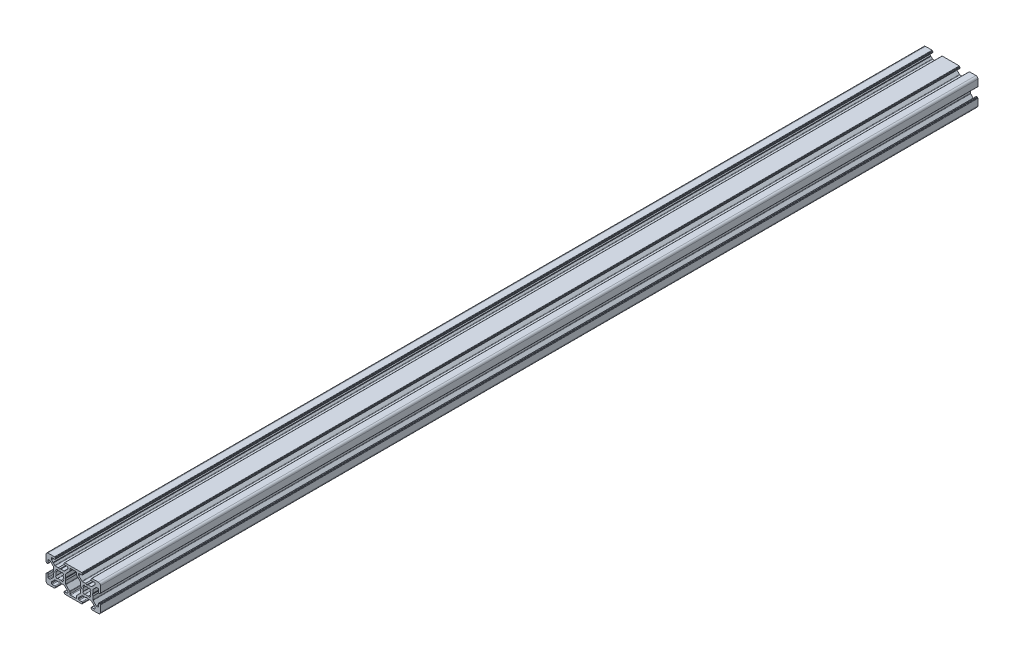
from build123d import *

# Parameters (mm, degrees)
EXTRUDE_827_DEPTH = 322.5


with BuildPart() as part:
    # Model → Extrude 827 (new, symmetric)
    with BuildSketch(Plane.XY):
        with BuildLine():
            Line((-14.790380224, 5.709619137), (-14.842144033, 5.902804302))
            Line((-14.842144033, 5.902804302), (-15.853552994, 6.914213263))
            ThreePointArc((-15.853552994, 6.914213263), (-15.96193937, 7.076424937), (-15.999999604, 7.267766654))
            Line((-15.999999604, 7.267766654), (-15.999999604, 7.999999642))
            ThreePointArc((-15.999999604, 7.999999642), (-15.853552994, 8.353553033), (-15.499999604, 8.499999642))
            Line((-15.499999604, 8.499999642), (-13.599999999, 8.499999642))
            ThreePointArc((-13.599999999, 8.499999642), (-13.246446608, 8.646446251), (-13.099999999, 8.999999642))
            Line((-13.099999999, 8.999999642), (-13.099999999, 9.299999969))
            ThreePointArc((-13.099999999, 9.299999969), (-13.158578643, 9.441421325), (-13.299999999, 9.499999969))
            Line((-13.299999999, 9.499999969), (-13.350000227, 9.499999969))
            ThreePointArc((-13.350000227, 9.499999969), (-13.491421583, 9.558578612), (-13.550000227, 9.699999969))
            Line((-13.550000227, 9.699999969), (-13.550000227, 9.799999969))
            ThreePointArc((-13.550000227, 9.799999969), (-13.60857887, 9.941421325), (-13.750000227, 9.999999969))
            Line((-13.750000227, 9.999999969), (-18.499999999, 9.999999969))
            ThreePointArc((-18.499999999, 9.999999969), (-19.560660171, 9.56066014), (-19.999999999, 8.499999969))
            Line((-19.999999999, 8.499999969), (-19.999999999, 3.750000196))
            ThreePointArc((-19.999999999, 3.750000196), (-19.941421355, 3.60857884), (-19.799999999, 3.550000196))
            Line((-19.799999999, 3.550000196), (-19.699999999, 3.550000196))
            ThreePointArc((-19.699999999, 3.550000196), (-19.558578643, 3.491421552), (-19.499999999, 3.350000196))
            Line((-19.499999999, 3.350000196), (-19.499999999, 3.299999969))
            ThreePointArc((-19.499999999, 3.299999969), (-19.441421355, 3.158578612), (-19.299999999, 3.099999969))
            Line((-19.299999999, 3.099999969), (-18.999999672, 3.099999969))
            ThreePointArc((-18.999999672, 3.099999969), (-18.646446282, 3.246446578), (-18.499999672, 3.599999969))
            Line((-18.499999672, 3.599999969), (-18.499999672, 5.500000655))
            ThreePointArc((-18.499999672, 5.500000655), (-18.353553063, 5.853554045), (-17.999999672, 6.000000655))
            Line((-17.999999672, 6.000000655), (-17.267766625, 6.000000655))
            ThreePointArc((-17.267766625, 6.000000655), (-17.076424898, 5.961940416), (-16.914213218, 5.853554028))
            Line((-16.914213218, 5.853554028), (-14.646446591, 3.585787181))
            ThreePointArc((-14.646446591, 3.585787181), (-14.538060228, 3.423575512), (-14.499999999, 3.232233807))
            Line((-14.499999999, 3.232233807), (-14.499999999, 0.95359028))
            ThreePointArc((-14.499999999, 0.95359028), (-14.493185165, 0.901826474), (-14.473205082, 0.853590285))
            Line((-14.473205082, 0.853590285), (-14.038119561, 0.100000013))
            ThreePointArc((-14.038119561, 0.100000013), (-14.011324631, -3.1e-08), (-14.038119561, -0.100000076))
            Line((-14.038119561, -0.100000076), (-14.473205082, -0.853590347))
            ThreePointArc((-14.473205082, -0.853590347), (-14.493185165, -0.901826537), (-14.499999999, -0.953590343))
            Line((-14.499999999, -0.953590343), (-14.499999999, -3.23223387))
            ThreePointArc((-14.499999999, -3.23223387), (-14.538060228, -3.423575575), (-14.646446591, -3.585787243))
            Line((-14.646446591, -3.585787243), (-16.914213218, -5.853554091))
            ThreePointArc((-16.914213218, -5.853554091), (-17.076424898, -5.961940479), (-17.267766625, -6.000000717))
            Line((-17.267766625, -6.000000717), (-17.999999672, -6.000000717))
            ThreePointArc((-17.999999672, -6.000000717), (-18.353553063, -5.853554108), (-18.499999672, -5.500000717))
            Line((-18.499999672, -5.500000717), (-18.499999672, -3.600000031))
            ThreePointArc((-18.499999672, -3.600000031), (-18.646446282, -3.246446641), (-18.999999672, -3.100000031))
            Line((-18.999999672, -3.100000031), (-19.299999999, -3.100000031))
            ThreePointArc((-19.299999999, -3.100000031), (-19.441421355, -3.158578675), (-19.499999999, -3.300000031))
            Line((-19.499999999, -3.300000031), (-19.499999999, -3.350000259))
            ThreePointArc((-19.499999999, -3.350000259), (-19.558578643, -3.491421615), (-19.699999999, -3.550000259))
            Line((-19.699999999, -3.550000259), (-19.799999999, -3.550000259))
            ThreePointArc((-19.799999999, -3.550000259), (-19.941421355, -3.608578903), (-19.999999999, -3.750000259))
            Line((-19.999999999, -3.750000259), (-19.999999999, -8.500000031))
            ThreePointArc((-19.999999999, -8.500000031), (-19.560660171, -9.560660203), (-18.499999999, -10.000000031))
            Line((-18.499999999, -10.000000031), (-13.750000227, -10.000000031))
            ThreePointArc((-13.750000227, -10.000000031), (-13.60857887, -9.941421388), (-13.550000227, -9.800000031))
            Line((-13.550000227, -9.800000031), (-13.550000227, -9.700000031))
            ThreePointArc((-13.550000227, -9.700000031), (-13.491421583, -9.558578675), (-13.350000227, -9.500000031))
            Line((-13.350000227, -9.500000031), (-13.299999999, -9.500000031))
            ThreePointArc((-13.299999999, -9.500000031), (-13.158578643, -9.441421388), (-13.099999999, -9.300000031))
            Line((-13.099999999, -9.300000031), (-13.099999999, -8.999999705))
            ThreePointArc((-13.099999999, -8.999999705), (-13.246446608, -8.646446314), (-13.599999999, -8.499999705))
            Line((-13.599999999, -8.499999705), (-15.499999604, -8.499999705))
            ThreePointArc((-15.499999604, -8.499999705), (-15.853552994, -8.353553095), (-15.999999604, -7.999999705))
            Line((-15.999999604, -7.999999705), (-15.999999604, -7.267766658))
            ThreePointArc((-15.999999604, -7.267766658), (-15.96193937, -7.076424942), (-15.853552994, -6.914213267))
            Line((-15.853552994, -6.914213267), (-13.585786098, -4.646446371))
            ThreePointArc((-13.585786098, -4.646446371), (-13.423574424, -4.538059995), (-13.232232708, -4.499999762))
            Line((-13.232232708, -4.499999762), (-10.953589301, -4.499999762))
            ThreePointArc((-10.953589301, -4.499999762), (-10.901825489, -4.493184926), (-10.853589297, -4.47320484))
            Line((-10.853589297, -4.47320484), (-10.099999968, -4.038119814))
            ThreePointArc((-10.099999968, -4.038119814), (-9.999999999, -4.011324902), (-9.90000003, -4.038119814))
            Line((-9.90000003, -4.038119814), (-9.146410702, -4.47320484))
            ThreePointArc((-9.146410702, -4.47320484), (-9.098174509, -4.493184926), (-9.046410697, -4.499999762))
            Line((-9.046410697, -4.499999762), (-6.767767291, -4.499999762))
            ThreePointArc((-6.767767291, -4.499999762), (-6.576425574, -4.538059995), (-6.4142139, -4.646446371))
            Line((-6.4142139, -4.646446371), (-4.146447004, -6.914213267))
            ThreePointArc((-4.146447004, -6.914213267), (-4.038060628, -7.076424942), (-4.000000394, -7.267766658))
            Line((-4.000000394, -7.267766658), (-4.000000394, -7.999999646))
            ThreePointArc((-4.000000394, -7.999999646), (-4.146447004, -8.353553037), (-4.500000394, -8.499999646))
            Line((-4.500000394, -8.499999646), (-6.399999999, -8.499999646))
            ThreePointArc((-6.399999999, -8.499999646), (-6.75355339, -8.646446255), (-6.899999999, -8.999999646))
            Line((-6.899999999, -8.999999646), (-6.899999999, -9.299999973))
            ThreePointArc((-6.899999999, -9.299999973), (-6.841421355, -9.441421329), (-6.699999999, -9.499999973))
            Line((-6.699999999, -9.499999973), (-6.649999772, -9.499999973))
            ThreePointArc((-6.649999772, -9.499999973), (-6.508578415, -9.558578616), (-6.449999772, -9.699999973))
            Line((-6.449999772, -9.699999973), (-6.449999772, -9.799999973))
            ThreePointArc((-6.449999772, -9.799999973), (-6.391421128, -9.941421329), (-6.249999772, -9.999999973))
            Line((-6.249999772, -9.999999973), (6.249999773, -9.999999973))
            ThreePointArc((6.249999773, -9.999999973), (6.39142113, -9.941421329), (6.449999773, -9.799999973))
            Line((6.449999773, -9.799999973), (6.449999773, -9.699999973))
            ThreePointArc((6.449999773, -9.699999973), (6.508578417, -9.558578616), (6.649999773, -9.499999973))
            Line((6.649999773, -9.499999973), (6.700000001, -9.499999973))
            ThreePointArc((6.700000001, -9.499999973), (6.841421357, -9.441421329), (6.900000001, -9.299999973))
            Line((6.900000001, -9.299999973), (6.900000001, -8.999999646))
            ThreePointArc((6.900000001, -8.999999646), (6.753553392, -8.646446255), (6.400000001, -8.499999646))
            Line((6.400000001, -8.499999646), (4.500000396, -8.499999646))
            ThreePointArc((4.500000396, -8.499999646), (4.146447006, -8.353553037), (4.000000396, -7.999999646))
            Line((4.000000396, -7.999999646), (4.000000396, -7.267766658))
            ThreePointArc((4.000000396, -7.267766658), (4.03806063, -7.076424942), (4.146447006, -6.914213267))
            Line((4.146447006, -6.914213267), (6.414213902, -4.646446371))
            ThreePointArc((6.414213902, -4.646446371), (6.576425576, -4.538059995), (6.767767292, -4.499999762))
            Line((6.767767292, -4.499999762), (9.046410699, -4.499999762))
            ThreePointArc((9.046410699, -4.499999762), (9.098174511, -4.493184926), (9.146410703, -4.47320484))
            Line((9.146410703, -4.47320484), (9.900000032, -4.038119814))
            ThreePointArc((9.900000032, -4.038119814), (10.000000001, -4.011324902), (10.09999997, -4.038119814))
            Line((10.09999997, -4.038119814), (10.853589298, -4.47320484))
            ThreePointArc((10.853589298, -4.47320484), (10.901825491, -4.493184926), (10.953589303, -4.499999762))
            Line((10.953589303, -4.499999762), (13.232232709, -4.499999762))
            ThreePointArc((13.232232709, -4.499999762), (13.423574426, -4.538059995), (13.5857861, -4.646446371))
            Line((13.5857861, -4.646446371), (15.853552996, -6.914213267))
            ThreePointArc((15.853552996, -6.914213267), (15.961939372, -7.076424942), (15.999999606, -7.267766658))
            Line((15.999999606, -7.267766658), (15.999999606, -7.999999705))
            ThreePointArc((15.999999606, -7.999999705), (15.853552996, -8.353553095), (15.499999606, -8.499999705))
            Line((15.499999606, -8.499999705), (13.600000001, -8.499999705))
            ThreePointArc((13.600000001, -8.499999705), (13.24644661, -8.646446314), (13.100000001, -8.999999705))
            Line((13.100000001, -8.999999705), (13.100000001, -9.300000031))
            ThreePointArc((13.100000001, -9.300000031), (13.158578645, -9.441421388), (13.300000001, -9.500000031))
            Line((13.300000001, -9.500000031), (13.350000228, -9.500000031))
            ThreePointArc((13.350000228, -9.500000031), (13.491421585, -9.558578675), (13.550000228, -9.700000031))
            Line((13.550000228, -9.700000031), (13.550000228, -9.800000031))
            ThreePointArc((13.550000228, -9.800000031), (13.608578872, -9.941421388), (13.750000228, -10.000000031))
            Line((13.750000228, -10.000000031), (18.500000001, -10.000000031))
            ThreePointArc((18.500000001, -10.000000031), (19.560660173, -9.560660203), (20.000000001, -8.500000031))
            Line((20.000000001, -8.500000031), (20.000000001, -3.750000259))
            ThreePointArc((20.000000001, -3.750000259), (19.941421357, -3.608578903), (19.800000001, -3.550000259))
            Line((19.800000001, -3.550000259), (19.700000001, -3.550000259))
            ThreePointArc((19.700000001, -3.550000259), (19.558578645, -3.491421615), (19.500000001, -3.350000259))
            Line((19.500000001, -3.350000259), (19.500000001, -3.300000031))
            ThreePointArc((19.500000001, -3.300000031), (19.441421357, -3.158578675), (19.300000001, -3.100000031))
            Line((19.300000001, -3.100000031), (18.999999674, -3.100000031))
            ThreePointArc((18.999999674, -3.100000031), (18.646446284, -3.246446641), (18.499999674, -3.600000031))
            Line((18.499999674, -3.600000031), (18.499999674, -5.500000717))
            ThreePointArc((18.499999674, -5.500000717), (18.353553065, -5.853554108), (17.999999674, -6.000000717))
            Line((17.999999674, -6.000000717), (17.267766627, -6.000000717))
            ThreePointArc((17.267766627, -6.000000717), (17.0764249, -5.961940479), (16.914213219, -5.853554091))
            Line((16.914213219, -5.853554091), (14.646446593, -3.585787243))
            ThreePointArc((14.646446593, -3.585787243), (14.53806023, -3.423575575), (14.500000001, -3.23223387))
            Line((14.500000001, -3.23223387), (14.500000001, -0.953590343))
            ThreePointArc((14.500000001, -0.953590343), (14.493185167, -0.901826537), (14.473205084, -0.853590347))
            Line((14.473205084, -0.853590347), (14.038119563, -0.100000076))
            ThreePointArc((14.038119563, -0.100000076), (14.011324633, -3.1e-08), (14.038119563, 0.100000013))
            Line((14.038119563, 0.100000013), (14.473205084, 0.853590285))
            ThreePointArc((14.473205084, 0.853590285), (14.493185167, 0.901826474), (14.500000001, 0.95359028))
            Line((14.500000001, 0.95359028), (14.500000001, 3.232233807))
            ThreePointArc((14.500000001, 3.232233807), (14.53806023, 3.423575512), (14.646446593, 3.585787181))
            Line((14.646446593, 3.585787181), (16.914213219, 5.853554028))
            ThreePointArc((16.914213219, 5.853554028), (17.0764249, 5.961940416), (17.267766627, 6.000000655))
            Line((17.267766627, 6.000000655), (17.999999674, 6.000000655))
            ThreePointArc((17.999999674, 6.000000655), (18.353553065, 5.853554045), (18.499999674, 5.500000655))
            Line((18.499999674, 5.500000655), (18.499999674, 3.599999969))
            ThreePointArc((18.499999674, 3.599999969), (18.646446284, 3.246446578), (18.999999674, 3.099999969))
            Line((18.999999674, 3.099999969), (19.300000001, 3.099999969))
            ThreePointArc((19.300000001, 3.099999969), (19.441421357, 3.158578612), (19.500000001, 3.299999969))
            Line((19.500000001, 3.299999969), (19.500000001, 3.350000196))
            ThreePointArc((19.500000001, 3.350000196), (19.558578645, 3.491421552), (19.700000001, 3.550000196))
            Line((19.700000001, 3.550000196), (19.800000001, 3.550000196))
            ThreePointArc((19.800000001, 3.550000196), (19.941421357, 3.60857884), (20.000000001, 3.750000196))
            Line((20.000000001, 3.750000196), (20.000000001, 8.499999969))
            ThreePointArc((20.000000001, 8.499999969), (19.560660173, 9.56066014), (18.500000001, 9.999999969))
            Line((18.500000001, 9.999999969), (13.750000228, 9.999999969))
            ThreePointArc((13.750000228, 9.999999969), (13.608578872, 9.941421325), (13.550000228, 9.799999969))
            Line((13.550000228, 9.799999969), (13.550000228, 9.699999969))
            ThreePointArc((13.550000228, 9.699999969), (13.491421585, 9.558578612), (13.350000228, 9.499999969))
            Line((13.350000228, 9.499999969), (13.300000001, 9.499999969))
            ThreePointArc((13.300000001, 9.499999969), (13.158578645, 9.441421325), (13.100000001, 9.299999969))
            Line((13.100000001, 9.299999969), (13.100000001, 8.999999642))
            ThreePointArc((13.100000001, 8.999999642), (13.24644661, 8.646446251), (13.600000001, 8.499999642))
            Line((13.600000001, 8.499999642), (15.499999606, 8.499999642))
            ThreePointArc((15.499999606, 8.499999642), (15.853552996, 8.353553033), (15.999999606, 7.999999642))
            Line((15.999999606, 7.999999642), (15.999999606, 7.267766654))
            ThreePointArc((15.999999606, 7.267766654), (15.961939372, 7.076424937), (15.853552996, 6.914213263))
            Line((15.853552996, 6.914213263), (13.5857861, 4.646446367))
            ThreePointArc((13.5857861, 4.646446367), (13.423574426, 4.538059991), (13.232232709, 4.499999757))
            Line((13.232232709, 4.499999757), (10.953589303, 4.499999757))
            ThreePointArc((10.953589303, 4.499999757), (10.901825491, 4.493184922), (10.853589298, 4.473204836))
            Line((10.853589298, 4.473204836), (10.09999997, 4.03811981))
            ThreePointArc((10.09999997, 4.03811981), (10.000000001, 4.011324897), (9.900000032, 4.03811981))
            Line((9.900000032, 4.03811981), (9.146410703, 4.473204836))
            ThreePointArc((9.146410703, 4.473204836), (9.098174511, 4.493184922), (9.046410699, 4.499999757))
            Line((9.046410699, 4.499999757), (6.767767292, 4.499999757))
            ThreePointArc((6.767767292, 4.499999757), (6.576425576, 4.538059991), (6.414213902, 4.646446367))
            Line((6.414213902, 4.646446367), (4.146447006, 6.914213263))
            ThreePointArc((4.146447006, 6.914213263), (4.03806063, 7.076424937), (4.000000396, 7.267766654))
            Line((4.000000396, 7.267766654), (4.000000396, 7.999999734))
            ThreePointArc((4.000000396, 7.999999734), (4.146446629, 8.35355271), (4.499999315, 8.499999642))
            Line((4.499999315, 8.499999642), (6.400000001, 8.499999642))
            ThreePointArc((6.400000001, 8.499999642), (6.753553392, 8.646446251), (6.900000001, 8.999999642))
            Line((6.900000001, 8.999999642), (6.900000001, 9.299999969))
            ThreePointArc((6.900000001, 9.299999969), (6.841421357, 9.441421325), (6.700000001, 9.499999969))
            Line((6.700000001, 9.499999969), (6.649999773, 9.499999969))
            ThreePointArc((6.649999773, 9.499999969), (6.508578417, 9.558578612), (6.449999773, 9.699999969))
            Line((6.449999773, 9.699999969), (6.449999773, 9.799999969))
            ThreePointArc((6.449999773, 9.799999969), (6.39142113, 9.941421325), (6.249999773, 9.999999969))
            Line((6.249999773, 9.999999969), (-6.249999772, 9.999999969))
            ThreePointArc((-6.249999772, 9.999999969), (-6.391421128, 9.941421325), (-6.449999772, 9.799999969))
            Line((-6.449999772, 9.799999969), (-6.449999772, 9.699999969))
            ThreePointArc((-6.449999772, 9.699999969), (-6.508578415, 9.558578612), (-6.649999772, 9.499999969))
            Line((-6.649999772, 9.499999969), (-6.699999999, 9.499999969))
            ThreePointArc((-6.699999999, 9.499999969), (-6.841421355, 9.441421325), (-6.899999999, 9.299999969))
            Line((-6.899999999, 9.299999969), (-6.899999999, 8.999999642))
            ThreePointArc((-6.899999999, 8.999999642), (-6.75355339, 8.646446251), (-6.399999999, 8.499999642))
            Line((-6.399999999, 8.499999642), (-4.500000302, 8.499999642))
            ThreePointArc((-4.500000302, 8.499999642), (-4.146446965, 8.353553048), (-4.000000394, 7.999999701))
            Line((-4.000000394, 7.999999701), (-4.000000394, 7.267766654))
            ThreePointArc((-4.000000394, 7.267766654), (-4.038060628, 7.076424937), (-4.146447004, 6.914213263))
            Line((-4.146447004, 6.914213263), (-6.4142139, 4.646446367))
            ThreePointArc((-6.4142139, 4.646446367), (-6.576425574, 4.538059991), (-6.767767291, 4.499999757))
            Line((-6.767767291, 4.499999757), (-9.046410697, 4.499999757))
            ThreePointArc((-9.046410697, 4.499999757), (-9.098174509, 4.493184922), (-9.146410702, 4.473204836))
            Line((-9.146410702, 4.473204836), (-9.90000003, 4.03811981))
            ThreePointArc((-9.90000003, 4.03811981), (-9.999999999, 4.011324897), (-10.099999968, 4.03811981))
            Line((-10.099999968, 4.03811981), (-10.853589297, 4.473204836))
            ThreePointArc((-10.853589297, 4.473204836), (-10.901825489, 4.493184922), (-10.953589301, 4.499999757))
            Line((-10.953589301, 4.499999757), (-13.232232708, 4.499999757))
            ThreePointArc((-13.232232708, 4.499999757), (-13.423574424, 4.538059991), (-13.585786098, 4.646446367))
            Line((-13.585786098, 4.646446367), (-14.597195059, 5.657855328))
            Line((-14.597195059, 5.657855328), (-14.790380224, 5.709619137))
        make_face()
        with BuildLine():
            Line((8.090069039, 2.992174922), (8.741814684, 2.445295392))
            ThreePointArc((8.741814684, 2.445295392), (10.000000001, 2.749999969), (11.258185318, 2.445295392))
            Line((11.258185318, 2.445295392), (11.909930962, 2.992174922))
            ThreePointArc((11.909930962, 2.992174922), (12.508410486, 2.511737229), (12.989640963, 1.913894988))
            Line((12.989640963, 1.913894988), (12.445295363, 1.258185405))
            ThreePointArc((12.445295363, 1.258185405), (12.750000001, -3.1e-08), (12.445295363, -1.258185468))
            Line((12.445295363, -1.258185468), (12.989640963, -1.913895051))
            ThreePointArc((12.989640963, -1.913895051), (12.508410486, -2.511737292), (11.909930962, -2.992174985))
            Line((11.909930962, -2.992174985), (11.258185318, -2.445295455))
            ThreePointArc((11.258185318, -2.445295455), (10.000000001, -2.750000031), (8.741814684, -2.445295455))
            Line((8.741814684, -2.445295455), (8.090069039, -2.992174985))
            ThreePointArc((8.090069039, -2.992174985), (7.491589516, -2.511737292), (7.010359039, -1.913895051))
            Line((7.010359039, -1.913895051), (7.554704639, -1.258185468))
            ThreePointArc((7.554704639, -1.258185468), (7.250000001, -3.1e-08), (7.554704639, 1.258185405))
            Line((7.554704639, 1.258185405), (7.010359039, 1.913894988))
            ThreePointArc((7.010359039, 1.913894988), (7.491589516, 2.511737229), (8.090069039, 2.992174922))
        make_face(mode=Mode.SUBTRACT)
        with BuildLine():
            Line((-7.010359037, 1.913894988), (-7.554704637, 1.258185405))
            ThreePointArc((-7.554704637, 1.258185405), (-7.249999999, -3.1e-08), (-7.554704637, -1.258185468))
            Line((-7.554704637, -1.258185468), (-7.010359037, -1.913895051))
            ThreePointArc((-7.010359037, -1.913895051), (-7.491589514, -2.511737292), (-8.090069038, -2.992174985))
            Line((-8.090069038, -2.992174985), (-8.741814682, -2.445295455))
            ThreePointArc((-8.741814682, -2.445295455), (-9.999999999, -2.750000031), (-11.258185316, -2.445295455))
            Line((-11.258185316, -2.445295455), (-11.909930961, -2.992174985))
            ThreePointArc((-11.909930961, -2.992174985), (-12.508410484, -2.511737292), (-12.989640961, -1.913895051))
            Line((-12.989640961, -1.913895051), (-12.445295361, -1.258185468))
            ThreePointArc((-12.445295361, -1.258185468), (-12.749999999, -3.1e-08), (-12.445295361, 1.258185405))
            Line((-12.445295361, 1.258185405), (-12.989640961, 1.913894988))
            ThreePointArc((-12.989640961, 1.913894988), (-12.508410484, 2.511737229), (-11.909930961, 2.992174922))
            Line((-11.909930961, 2.992174922), (-11.258185316, 2.445295392))
            ThreePointArc((-11.258185316, 2.445295392), (-9.999999999, 2.749999969), (-8.741814682, 2.445295392))
            Line((-8.741814682, 2.445295392), (-8.090069038, 2.992174922))
            ThreePointArc((-8.090069038, 2.992174922), (-7.491589514, 2.511737229), (-7.010359037, 1.913894988))
        make_face(mode=Mode.SUBTRACT)
        with BuildLine():
            Line((5.526682017, 0.85378582), (5.961880479, 0.100000015))
            ThreePointArc((5.961880479, 0.100000015), (5.988675404, 4e-09), (5.961880483, -0.100000009))
            Line((5.961880483, -0.100000009), (5.526682014, -0.853785889))
            ThreePointArc((5.526682014, -0.853785889), (5.50670193, -0.902022079), (5.499887096, -0.953785887))
            Line((5.499887096, -0.953785887), (5.499887096, -3.232425683))
            ThreePointArc((5.499887096, -3.232425683), (5.461825468, -3.423770765), (5.353435334, -3.585984226))
            Line((5.353435334, -3.585984226), (2.646451763, -6.292888902))
            ThreePointArc((2.646451763, -6.292888902), (2.538061629, -6.455102363), (2.500000001, -6.646447445))
            Line((2.500000001, -6.646447445), (2.500000001, -7.99999982))
            ThreePointArc((2.500000001, -7.99999982), (2.353553392, -8.35355321), (2.000000001, -8.49999982))
            Line((2.000000001, -8.49999982), (-1.999999999, -8.49999982))
            ThreePointArc((-1.999999999, -8.49999982), (-2.35355339, -8.35355321), (-2.499999999, -7.99999982))
            Line((-2.499999999, -7.99999982), (-2.499999999, -6.646447445))
            ThreePointArc((-2.499999999, -6.646447445), (-2.538060306, -6.455105552), (-2.646446878, -6.292893784))
            Line((-2.646446878, -6.292893784), (-5.353542339, -3.585802459))
            ThreePointArc((-5.353542339, -3.585802459), (-5.461928911, -3.423590691), (-5.499989218, -3.232248799))
            Line((-5.499989218, -3.232248799), (-5.499989218, -0.953609003))
            ThreePointArc((-5.499989218, -0.953609003), (-5.506804053, -0.901845195), (-5.526784136, -0.853609005))
            Line((-5.526784136, -0.853609005), (-5.961880481, -0.100000009))
            ThreePointArc((-5.961880481, -0.100000009), (-5.988675402, 4e-09), (-5.961880477, 0.100000015))
            Line((-5.961880477, 0.100000015), (-5.52678414, 0.853608936))
            ThreePointArc((-5.52678414, 0.853608936), (-5.506804054, 0.901845129), (-5.499989218, 0.95360894))
            Line((-5.499989218, 0.95360894), (-5.499989218, 3.232248736))
            ThreePointArc((-5.499989218, 3.232248736), (-5.461928911, 3.423590629), (-5.353542339, 3.585802397))
            Line((-5.353542339, 3.585802397), (-2.64644716, 6.29289344))
            ThreePointArc((-2.64644716, 6.29289344), (-2.538060587, 6.455105208), (-2.50000028, 6.646447101))
            Line((-2.50000028, 6.646447101), (-2.50000028, 7.999999757))
            ThreePointArc((-2.50000028, 7.999999757), (-2.353553671, 8.353553147), (-2.00000028, 8.499999757))
            Line((-2.00000028, 8.499999757), (2.00000028, 8.499999757))
            ThreePointArc((2.00000028, 8.499999757), (2.353553671, 8.353553147), (2.50000028, 7.999999757))
            Line((2.50000028, 7.999999757), (2.50000028, 6.646447103))
            ThreePointArc((2.50000028, 6.646447103), (2.538061908, 6.455102021), (2.646452042, 6.29288856))
            Line((2.646452042, 6.29288856), (5.353435334, 3.585984163))
            ThreePointArc((5.353435334, 3.585984163), (5.461825468, 3.423770703), (5.499887096, 3.232425621))
            Line((5.499887096, 3.232425621), (5.499887096, 0.953785825))
            ThreePointArc((5.499887096, 0.953785825), (5.506701931, 0.902022013), (5.526682017, 0.85378582))
        make_face(mode=Mode.SUBTRACT)
    extrude(amount=EXTRUDE_827_DEPTH, both=True)


solid = part.part
